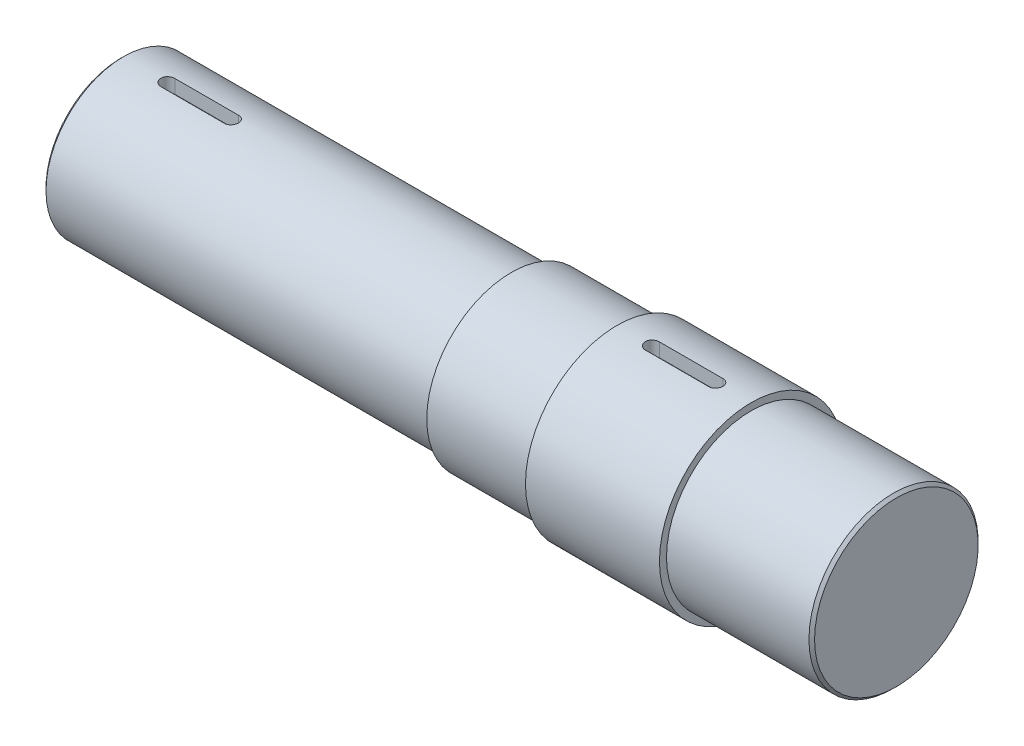
from build123d import *

# Parameters (mm, degrees)
CHAFL_N1_SIZE         = 2
CHAFL_N2_SIZE         = 2
CORTAR_EXTRUIR1_DEPTH = 10
CORTAR_EXTRUIR2_DEPTH = 10


with BuildPart() as part:
    # Croquis1 → Revolución2 (revolve)
    with BuildSketch(Plane(origin=(0, 0, 0), x_dir=(1, 0, 0), z_dir=(0, 1, 0)), mode=Mode.PRIVATE) as revoluci_n2_sk:
        Polygon((0, 0), (550, 0), (550, 60), (447, 60), (447, 65), (352, 65), (352, 60), (277, 60), (277, 55), (0, 55), align=None)
    revolve(revoluci_n2_sk.sketch.rotate(Axis((0, 0, 0), (1, 0, 0)), 180), axis=Axis((0, 0, 0), (1, 0, 0)))

    # Chaflán1
    chafl_n1_edges = [part.edges().sort_by_distance(p)[0] for p in [
        (0, 0, -55),
    ]]
    chamfer(chafl_n1_edges, length=CHAFL_N1_SIZE)

    # Chaflán2
    chafl_n2_edges = [part.edges().sort_by_distance(p)[0] for p in [
        (550, 0, -60),
    ]]
    chamfer(chafl_n2_edges, length=CHAFL_N2_SIZE)

    # Croquis2 → Cortar-Extruir1 (cut)
    with BuildSketch(Plane(origin=(0, 65, 0), x_dir=(1, 0, 0), z_dir=(0, 1, 0))):
        with BuildLine():
            Line((377, -5), (422, -5))
            ThreePointArc((422, -5), (427, 0), (422, 5))
            Line((422, 5), (377, 5))
            ThreePointArc((377, 5), (372, 0), (377, -5))
        make_face()
    extrude(amount=-CORTAR_EXTRUIR1_DEPTH, mode=Mode.SUBTRACT)

    # Croquis3 → Cortar-Extruir2 (cut)
    with BuildSketch(Plane(origin=(0, 55, 0), x_dir=(1, 0, 0), z_dir=(0, 1, 0))):
        with BuildLine():
            Line((33.490249976, -5), (78.490249976, -5))
            ThreePointArc((78.490249976, -5), (83.490249976, 0), (78.490249976, 5))
            Line((78.490249976, 5), (33.490249976, 5))
            ThreePointArc((33.490249976, 5), (28.490249976, 0), (33.490249976, -5))
        make_face()
    extrude(amount=-CORTAR_EXTRUIR2_DEPTH, mode=Mode.SUBTRACT)


solid = part.part
